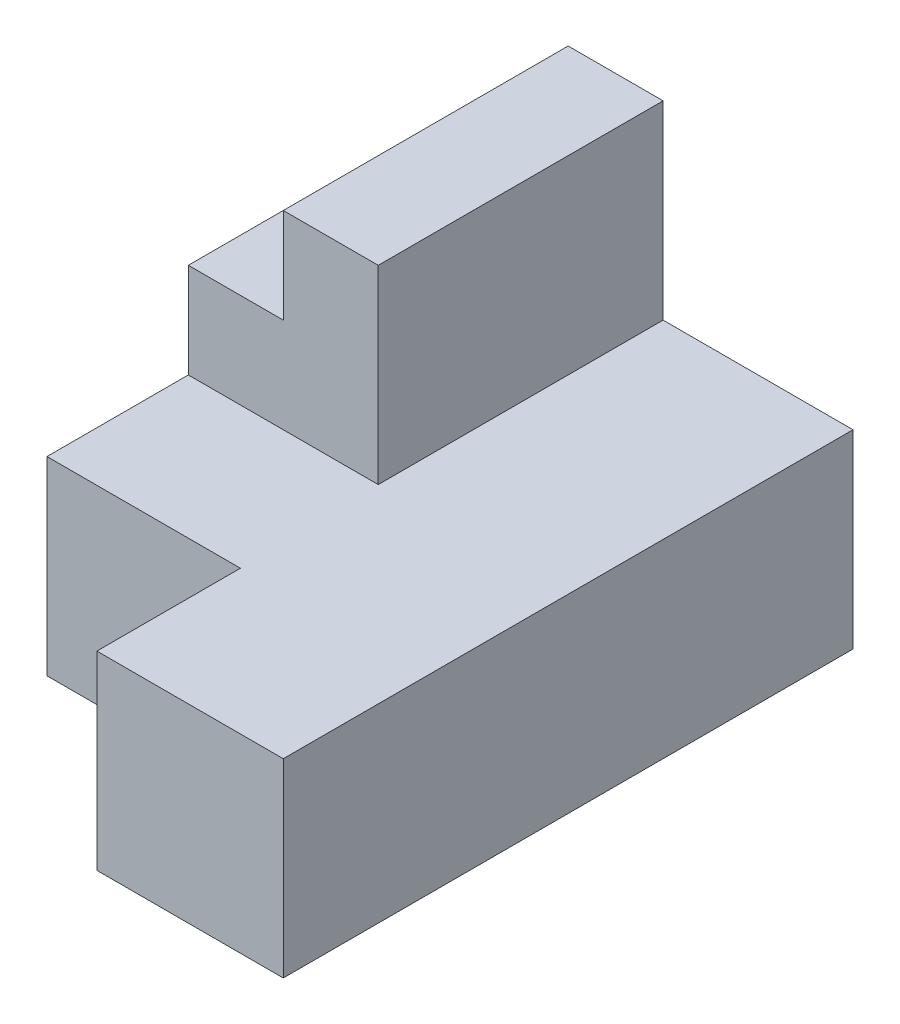
from build123d import *

# Parameters (mm, degrees)
SKETCH1_W           = 40
SKETCH1_H           = 40
BOSS_EXTRUDE1_DEPTH = 60
SKETCH2_W           = 20
SKETCH2_H           = 60
CUT_EXTRUDE1_DEPTH  = 20
SKETCH3_W           = 10
SKETCH3_H           = 30
CUT_EXTRUDE2_DEPTH  = 10
SKETCH4_W           = 20
SKETCH4_H           = 30
CUT_EXTRUDE3_DEPTH  = 20
SKETCH5_W           = 20.369010991
SKETCH5_H           = 15.116556711
CUT_EXTRUDE4_DEPTH  = 20


with BuildPart() as part:
    # Sketch1 → Boss-Extrude1 (new body)
    with BuildSketch(Plane.XY):
        with Locations((20, 20)):
            Rectangle(SKETCH1_W, SKETCH1_H)
    extrude(amount=BOSS_EXTRUDE1_DEPTH)

    # Sketch2 → Cut-Extrude1 (cut)
    with BuildSketch(Plane(origin=(0, 40, 0), x_dir=(1, 0, 0), z_dir=(0, 1, 0))):
        with Locations((30, -30)):
            Rectangle(SKETCH2_W, SKETCH2_H)
    extrude(amount=-CUT_EXTRUDE1_DEPTH, mode=Mode.SUBTRACT)

    # Sketch3 → Cut-Extrude2 (cut)
    with BuildSketch(Plane(origin=(0, 40, 0), x_dir=(1, 0, 0), z_dir=(0, 1, 0))):
        with Locations((5, -15)):
            Rectangle(SKETCH3_W, SKETCH3_H)
    extrude(amount=-CUT_EXTRUDE2_DEPTH, mode=Mode.SUBTRACT)

    # Sketch4 → Cut-Extrude3 (cut)
    with BuildSketch(Plane(origin=(0, 40, 0), x_dir=(1, 0, 0), z_dir=(0, 1, 0))):
        with Locations((10, -45)):
            Rectangle(SKETCH4_W, SKETCH4_H)
    extrude(amount=-CUT_EXTRUDE3_DEPTH, mode=Mode.SUBTRACT)

    # Sketch5 → Cut-Extrude4 (cut)
    with BuildSketch(Plane(origin=(0, 20, 0), x_dir=(1, 0, 0), z_dir=(0, 1, 0))):
        with Locations((10.184505495, -52.441721645)):
            Rectangle(SKETCH5_W, SKETCH5_H)
    extrude(amount=-CUT_EXTRUDE4_DEPTH, mode=Mode.SUBTRACT)


solid = part.part
